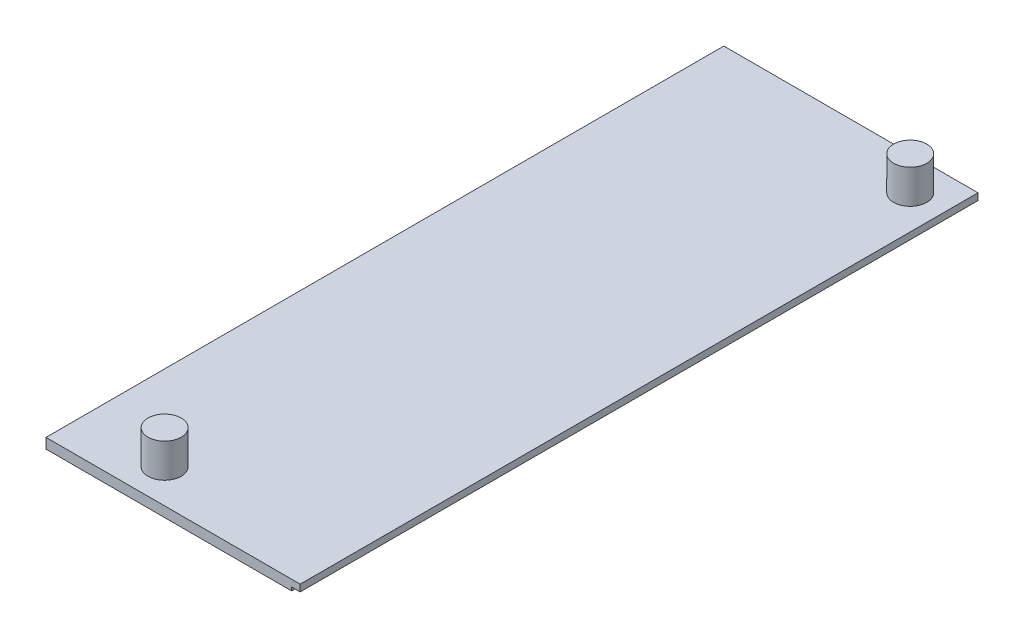
from build123d import *

# Parameters (mm, degrees)
SKETCH1_W           = 75
SKETCH1_H           = 3
BOSS_EXTRUDE1_DEPTH = 200
SKETCH2_R           = 4.9
BOSS_EXTRUDE2_DEPTH = 10
SKETCH5_W           = 2.5
SKETCH5_H           = 200
CUT_EXTRUDE2_DEPTH  = 1


with BuildPart() as part:
    # Sketch1 → Boss-Extrude1 (new body)
    with BuildSketch(Plane.XY):
        with Locations((37.5, 1.5)):
            Rectangle(SKETCH1_W, SKETCH1_H)
    extrude(amount=BOSS_EXTRUDE1_DEPTH)

    # Sketch2 → Boss-Extrude2 (add)
    with BuildSketch(Plane(origin=(0, 3, 0), x_dir=(1, 0, 0), z_dir=(0, 1, 0))):
        with Locations(Location((25, -190, 0), (0, 0, 90))):
            Circle(SKETCH2_R)
        with Locations(Location((65, -10, 0), (0, 0, 90))):
            Circle(SKETCH2_R)
        with Locations((165, -190)):
            Circle(SKETCH2_R)
        with Locations((85, -190)):
            Circle(SKETCH2_R)
        with Locations((-27.5, -10)):
            Circle(SKETCH2_R)
    extrude(amount=BOSS_EXTRUDE2_DEPTH)


with BuildPart() as boss_extrude2_kept_piece:
    # of the separate pieces the step leaves, the one the design keeps (boss_extrude2_pieces_kept)
    add(part.part.solids().sort_by_distance((0, 0, 0))[0])

    # Sketch5 → Cut-Extrude2 (cut)
    with BuildSketch(Plane.XZ):
        with Locations((73.75, 100)):
            Rectangle(SKETCH5_W, SKETCH5_H)
    extrude(amount=-CUT_EXTRUDE2_DEPTH, mode=Mode.SUBTRACT)


solid = boss_extrude2_kept_piece.part
